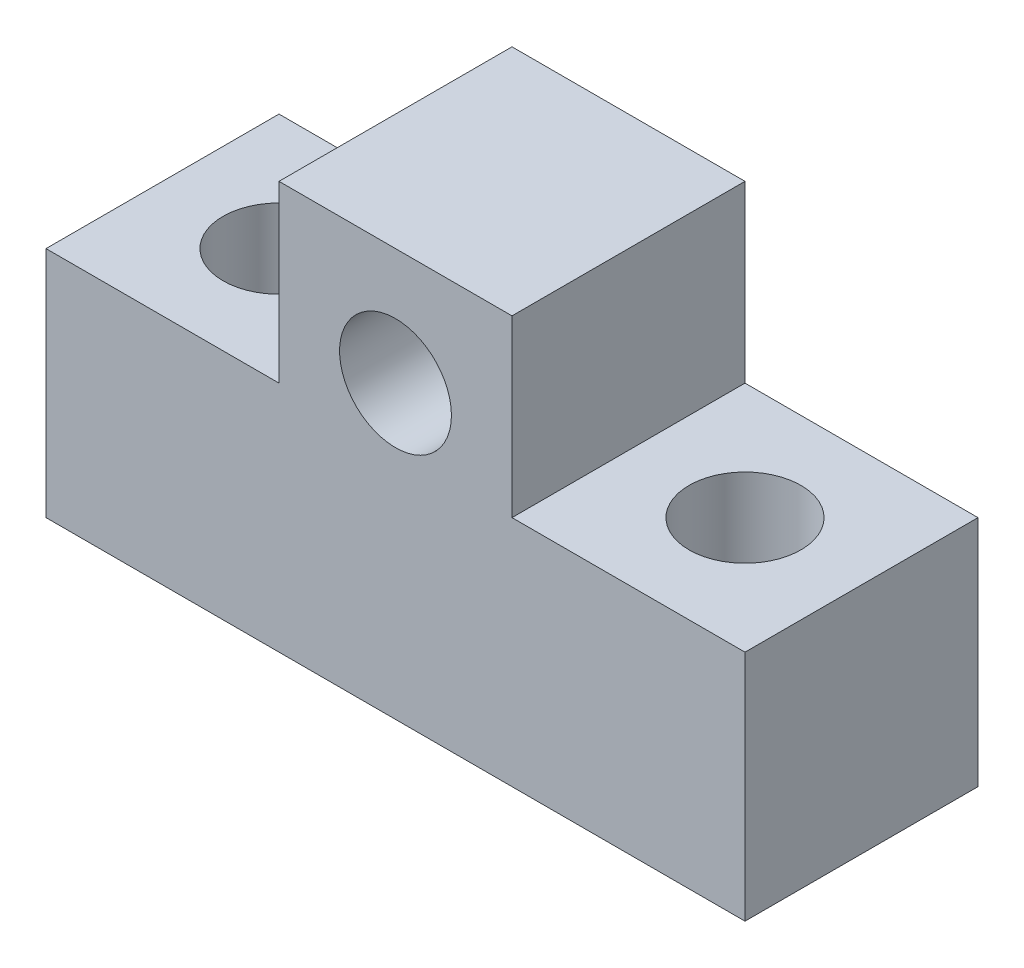
from build123d import *

# Parameters (mm, degrees)
SKETCH1_W                        = 19.05
SKETCH1_H                        = 6.35
BOSS_EXTRUDE1_DEPTH              = 6.35
SKETCH6_W                        = 6.35
SKETCH6_H                        = 6.35
BOSS_EXTRUDE2_DEPTH              = 4.7625
TAPPED_HOLE_FOR_4_40_HELICOIL1_D = 3.048
TAPPED_HOLE_FOR_4_40_HELICOIL2_D = 3.048


with BuildPart() as part:
    # Sketch1 → Boss-Extrude1 (new body)
    with BuildSketch(Plane.XY):
        Rectangle(SKETCH1_W, SKETCH1_H)
    extrude(amount=BOSS_EXTRUDE1_DEPTH)

    # Sketch6 → Boss-Extrude2 (add)
    with BuildSketch(Plane(origin=(0, 3.175, 0), x_dir=(1, 0, 0), z_dir=(0, 1, 0))):
        with Locations((0, -3.175)):
            Rectangle(SKETCH6_W, SKETCH6_H)
    extrude(amount=BOSS_EXTRUDE2_DEPTH)

    # Tapped Hole for #4-40 Helicoil1 (through all)
    with Locations(Plane(origin=(0, 3.175, 0), x_dir=(1, 0, 0), z_dir=(0, 1, 0))):
        with Locations((-6.35, -3.175), (6.35, -3.175)):
            Hole(TAPPED_HOLE_FOR_4_40_HELICOIL1_D / 2)

    # Tapped Hole for #4-40 Helicoil2 (through all)
    with Locations(Plane.XY.offset(6.35)):
        with Locations((0, 4.7625)):
            Hole(TAPPED_HOLE_FOR_4_40_HELICOIL2_D / 2)


solid = part.part
